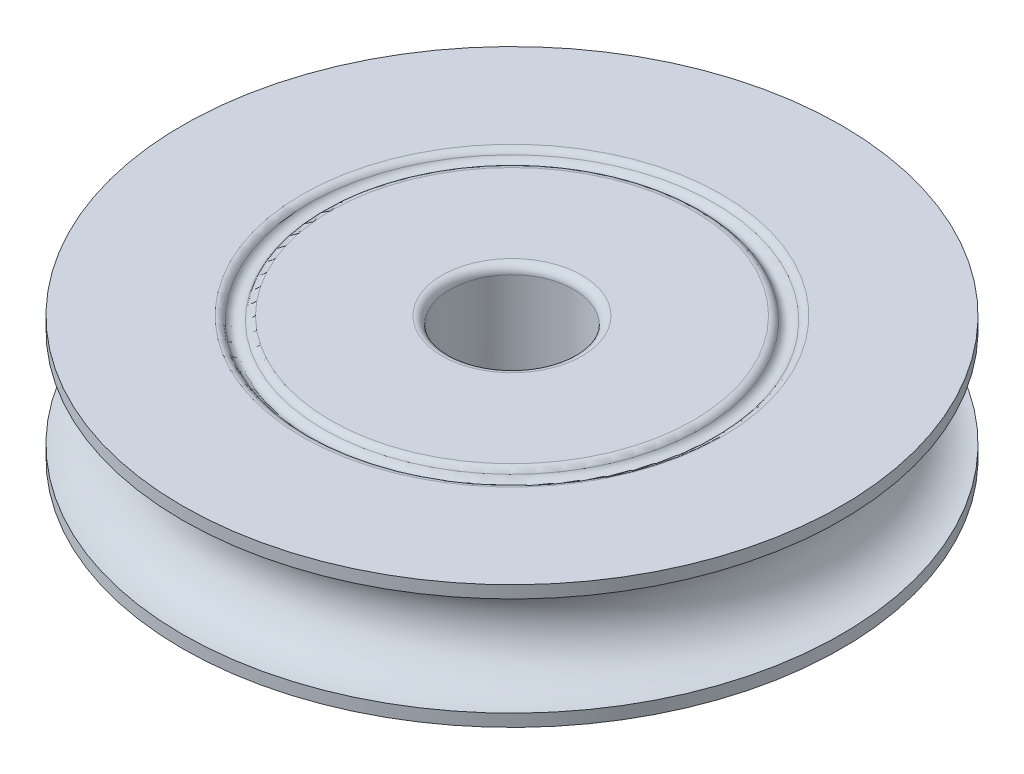
from build123d import *

# Parameters (mm, degrees)
FILLET2_R = 1
FILLET3_R = 1


with BuildPart() as part:
    # Sketch1 → Revolve1 (revolve)
    with BuildSketch(Plane(origin=(0, 0, 0), x_dir=(0, 0, -1), z_dir=(1, 0, 0))):
        with BuildLine():
            Line((-7.5, -7.5), (-22.75, -7.5))
            ThreePointArc((-22.75, -7.5), (-23.75, -6.5), (-24.75, -7.5))
            Line((-24.75, -7.5), (-40, -7.5))
            Line((-40, -7.5), (-40, -6))
            ThreePointArc((-40, -6), (-34, 0), (-40, 6))
            Line((-40, 6), (-40, 7.5))
            Line((-40, 7.5), (-24.75, 7.5))
            ThreePointArc((-24.75, 7.5), (-23.75, 6.5), (-22.75, 7.5))
            Line((-22.75, 7.5), (-7.5, 7.5))
            Line((-7.5, 7.5), (-7.5, -7.5))
        make_face()
    revolve(axis=Axis((0, 11.698596208, 0), (0, -1, 0)))

    # Fillet2
    fillet2_edges = [part.edges().sort_by_distance(p)[0] for p in [
        (0, -7.5, -24.75),
        (0, -7.5, -22.75),
        (0, 7.5, -22.75),
        (0, 7.5, -24.75),
    ]]
    fillet(fillet2_edges, radius=FILLET2_R)

    # Fillet3
    fillet3_edges = [part.edges().sort_by_distance(p)[0] for p in [
        (0, -7.5, -7.5),
        (0, 7.5, -7.5),
    ]]
    fillet(fillet3_edges, radius=FILLET3_R)


solid = part.part
